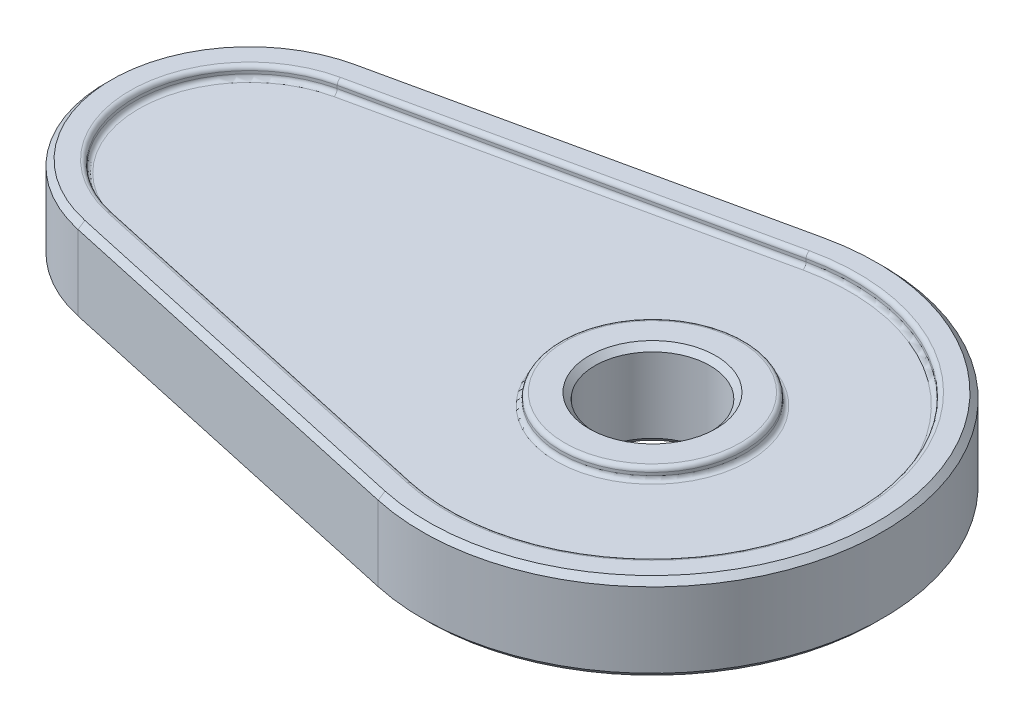
from build123d import *

# Parameters (mm, degrees)
SKETCH1_R           = 10
BOSS_EXTRUDE1_DEPTH = 7.5
CHAMFER1_SIZE       = 1
CHAMFER2_SIZE       = 1
SKETCH2_R           = 16
CUT_EXTRUDE1_DEPTH  = 2
FILLET1_R           = 0.75


with BuildPart() as part:
    # Sketch1 → Boss-Extrude1 (new, symmetric)
    with BuildSketch(Plane(origin=(0, 0, 0), x_dir=(1, 0, 0), z_dir=(0, 1, 0))):
        with BuildLine():
            Line((-75.357142857, 24.419275591), (-8.571428571, 39.070840946))
            ThreePointArc((-8.571428571, 39.070840946), (40, 0), (-8.571428571, -39.070840946))
            Line((-8.571428571, -39.070840946), (-75.357142857, -24.419275591))
            ThreePointArc((-75.357142857, -24.419275591), (-95, 0), (-75.357142857, 24.419275591))
        make_face()
        with Locations(Location((0, 0, 0), (0, 0, 270))):
            Circle(SKETCH1_R, mode=Mode.SUBTRACT)
    extrude(amount=BOSS_EXTRUDE1_DEPTH, both=True)

    # Chamfer1
    chamfer1_edges = [part.edges().sort_by_distance(p)[0] for p in [
        (40, 7.5, 0),
        (-41.964285714, 7.5, -31.745058269),
        (-95, 7.5, 0),
        (-41.964285714, -7.5, -31.745058269),
        (40, -7.5, 0),
        (-41.964285714, -7.5, 31.745058269),
        (-95, -7.5, 0),
        (-41.964285714, 7.5, 31.745058269),
    ]]
    chamfer(chamfer1_edges, length=CHAMFER1_SIZE)

    # Chamfer2
    chamfer2_edges = [part.edges().sort_by_distance(p)[0] for p in [
        (0, -7.5, -10),
        (0, 7.5, -10),
    ]]
    chamfer(chamfer2_edges, length=CHAMFER2_SIZE)

    # Sketch2 → Cut-Extrude1 (cut)
    with BuildSketch(Plane(origin=(0, 7.5, 0), x_dir=(1, 0, 0), z_dir=(0, 1, 0))):
        with BuildLine():
            Line((-74.285714286, 19.535420473), (-7.5, 34.186985828))
            ThreePointArc((-7.5, 34.186985828), (35, 0), (-7.5, -34.186985828))
            Line((-7.5, -34.186985828), (-74.285714286, -19.535420473))
            ThreePointArc((-74.285714286, -19.535420473), (-90, 0), (-74.285714286, 19.535420473))
        make_face()
        with Locations(Location((0, 0, 0), (0, 0, 270))):
            Circle(SKETCH2_R, mode=Mode.SUBTRACT)
    cut_extrude1 = extrude(amount=-CUT_EXTRUDE1_DEPTH, mode=Mode.SUBTRACT)

    # Mirror2: Cut-Extrude1 across plane
    add(cut_extrude1.mirror(Plane.ZX), mode=Mode.SUBTRACT)

    # Fillet1
    fillet1_edges = [part.edges().sort_by_distance(p)[0] for p in [
        (-40.892857143, 7.5, -26.861203151),
        (35, 5.5, 0),
        (-40.892857143, 7.5, 26.861203151),
        (0, 7.5, -16),
        (-90, 5.5, 0),
        (0, 5.5, -16),
        (-40.892857143, 5.5, -26.861203151),
        (-40.892857143, 5.5, 26.861203151),
        (-90, 7.5, 0),
        (35, 7.5, 0),
        (-40.892857143, -5.5, -26.861203151),
        (-90, -7.5, 0),
        (-40.892857143, -5.5, 26.861203151),
        (0, -5.5, -16),
        (35, -7.5, 0),
        (-90, -5.5, 0),
        (35, -5.5, 0),
        (0, -7.5, -16),
        (-40.892857143, -7.5, -26.861203151),
        (-40.892857143, -7.5, 26.861203151),
    ]]
    fillet(fillet1_edges, radius=FILLET1_R)


solid = part.part
